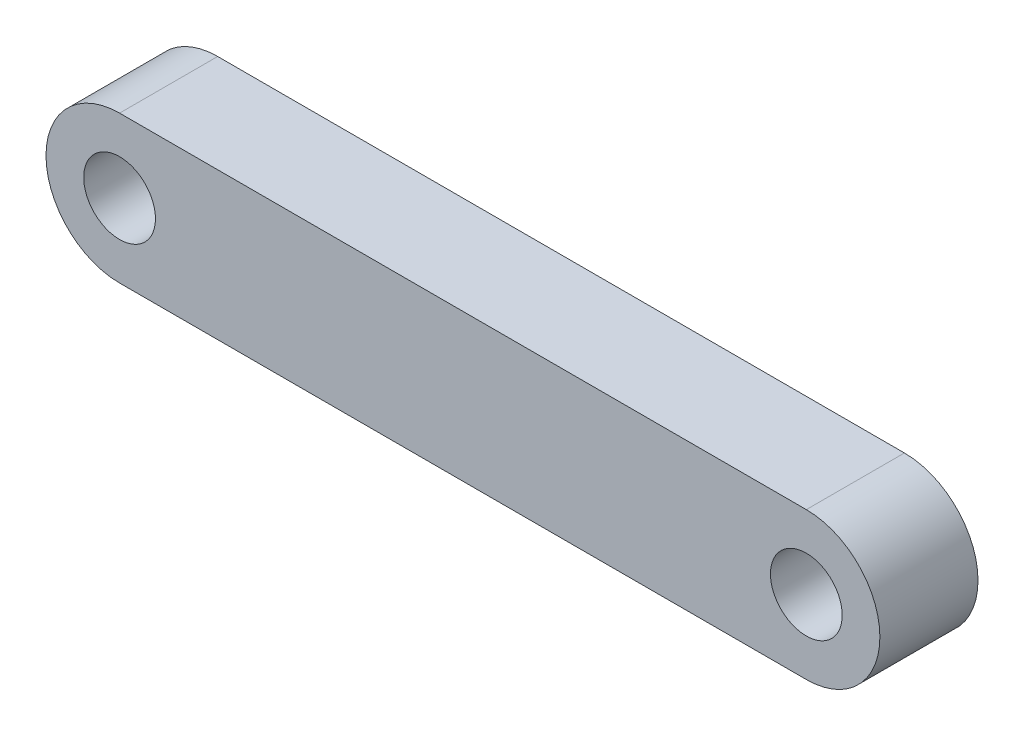
from build123d import *

# Parameters (mm, degrees)
SKETCH1_R           = 3.6576
BOSS_EXTRUDE1_DEPTH = 10


with BuildPart() as part:
    # Sketch1 → Boss-Extrude1 (new body)
    with BuildSketch(Plane.XY):
        with BuildLine():
            Line((0, 7.5), (70, 7.5))
            ThreePointArc((70, 7.5), (77.5, 0), (70, -7.5))
            Line((70, -7.5), (0, -7.5))
            ThreePointArc((0, -7.5), (-7.5, 0), (0, 7.5))
        make_face()
        Circle(SKETCH1_R, mode=Mode.SUBTRACT)
        with Locations((70, 0)):
            Circle(SKETCH1_R, mode=Mode.SUBTRACT)
    extrude(amount=BOSS_EXTRUDE1_DEPTH)


solid = part.part
